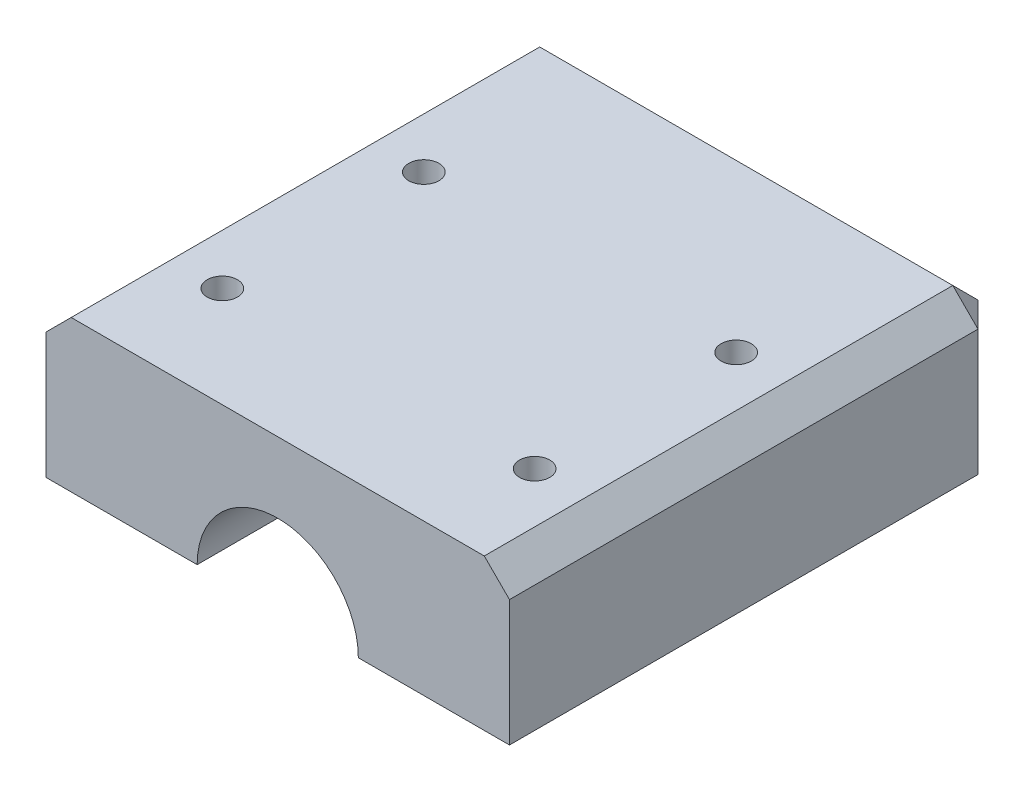
from build123d import *

# Parameters (mm, degrees)
Y_KSEKLIK_EKSTR_ZYON1_DEPTH = 45
IZIM2_W                     = 46
IZIM2_H                     = 5
Y_KSEKLIK_EKSTR_ZYON2_DEPTH = 14
Y_KSEKLIK_EKSTR_ZYON3_DEPTH = 4
PAH1_SIZE                   = 2.5
IZIM4_R                     = 1.5
KES_EKSTR_ZYON1_DEPTH       = 35


with BuildPart() as part:
    # Çizim1 → Yükseklik-Ekstrüzyon1 (new body)
    with BuildSketch(Plane.XY):
        with BuildLine():
            Line((-8, 0), (-23, 0))
            Line((-23, 0), (-23, 15))
            Line((-23, 15), (23, 15))
            Line((23, 15), (23, 0))
            Line((23, 0), (8, 0))
            ThreePointArc((8, 0), (0, 8), (-8, 0))
        make_face()
    extrude(amount=-Y_KSEKLIK_EKSTR_ZYON1_DEPTH)

    # Çizim2 → Yükseklik-Ekstrüzyon2 (add)
    with BuildSketch(Plane.XZ):
        with Locations((0, -42.5)):
            Rectangle(IZIM2_W, IZIM2_H)
    extrude(amount=-Y_KSEKLIK_EKSTR_ZYON2_DEPTH)

    # Çizim3 → Yükseklik-Ekstrüzyon3 (add)
    with BuildSketch(Plane(origin=(0, 0, -45), x_dir=(-1, 0, 0), z_dir=(0, 0, -1))):
        Polygon((-23, 15), (23, 15), (23, 4), (23, 0), (18, 0), (18, 4), (-18, 4), (-18, 0), (-23, 0), (-23, 4), align=None)
    extrude(amount=Y_KSEKLIK_EKSTR_ZYON3_DEPTH)

    # Pah1
    pah1_edges = [part.edges().sort_by_distance(p)[0] for p in [
        (-23, 15, -24.5),
        (23, 15, -24.5),
        (23, 7.5, -49),
        (-23, 7.5, -49),
        (0, 15, -49),
    ]]
    chamfer(pah1_edges, length=PAH1_SIZE)

    # Çizim4 → Kes-Ekstrüzyon1 (cut)
    with BuildSketch(Plane.XZ):
        with Locations((15.5, -10)):
            Circle(IZIM4_R)
        with Locations((15.5, -30)):
            Circle(IZIM4_R)
        with Locations(Location((-15.5, -30, 0), (0, 0, 180))):
            Circle(IZIM4_R)
        with Locations(Location((-15.5, -10, 0), (0, 0, 180))):
            Circle(IZIM4_R)
    extrude(amount=-KES_EKSTR_ZYON1_DEPTH, mode=Mode.SUBTRACT)


solid = part.part
